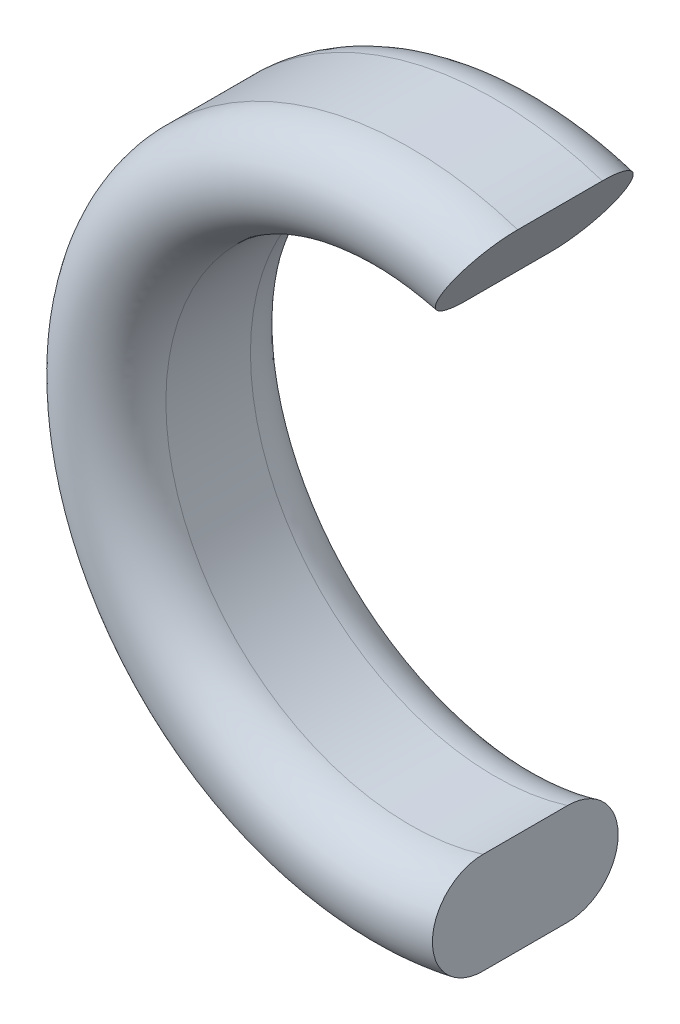
from build123d import *


with BuildPart() as part:
    # Süpür2: sweep along a path in Çizim1
    with BuildLine(Plane.XY) as s_p_r2_path:
        ThreePointArc((0, 0), (-60.511508606, 47.73042625), (1.481382133, 93.520357038))
    # Çizim2 → Süpür2 (sweep)
    with BuildSketch(Plane(origin=(0, 0, 0), x_dir=(0, 0, -1), z_dir=(1, 0, 0))):
        with BuildLine():
            Line((-6.996656418, 8.36565184), (6.996656418, 8.36565184))
            ThreePointArc((6.996656418, 8.36565184), (15.362308258, 0), (6.996656418, -8.36565184))
            Line((6.996656418, -8.36565184), (-6.996656418, -8.36565184))
            ThreePointArc((-6.996656418, -8.36565184), (-15.362308258, 0), (-6.996656418, 8.36565184))
        make_face()
    sweep(path=s_p_r2_path.line)


solid = part.part
